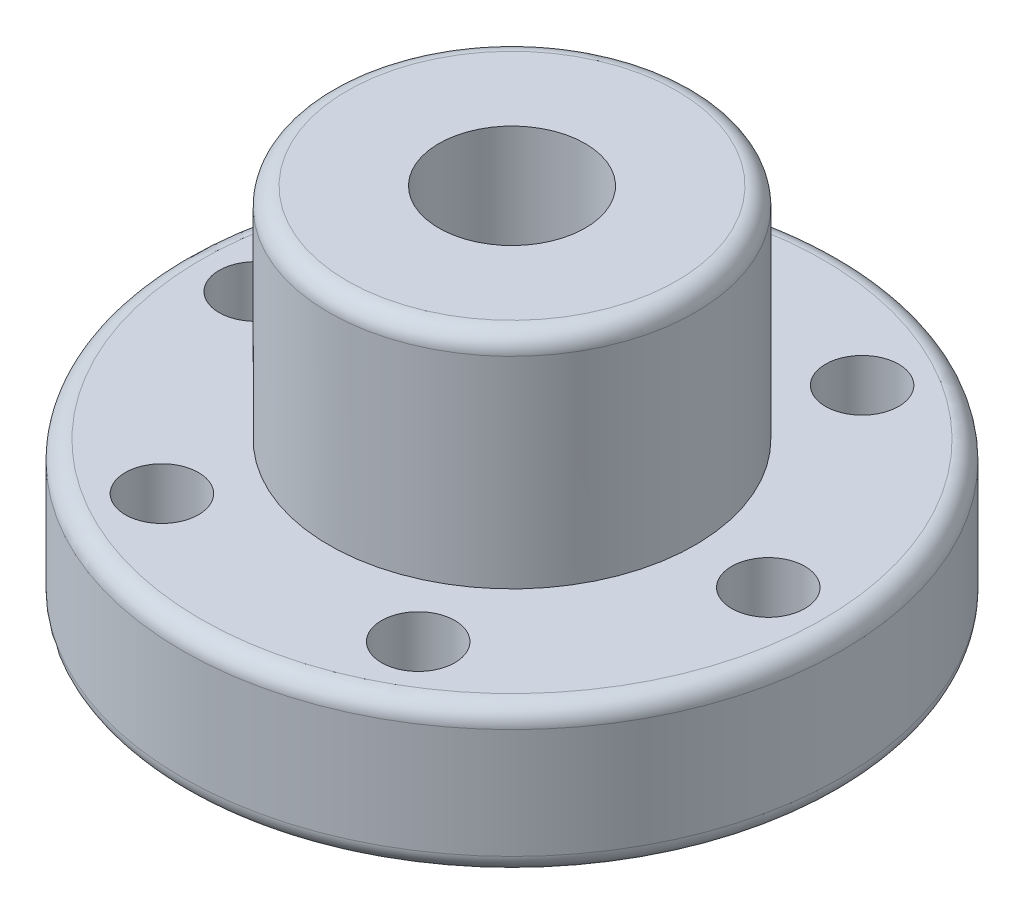
from build123d import *

# Parameters (mm, degrees)
FILLET1_R          = 1
SKETCH2_R          = 2
CUT_EXTRUDE1_DEPTH = 10


with BuildPart() as part:
    # Sketch1 → Revolve1 (revolve)
    with BuildSketch(Plane.XY, mode=Mode.PRIVATE) as revolve1_sk:
        Polygon((0, 0), (0, 20), (6, 20), (6, 8), (14, 8), (14, 0), align=None)
    revolve(revolve1_sk.sketch.rotate(Axis((-4, 0, 0), (0, 1, 0)), 90), axis=Axis((-4, 0, 0), (0, 1, 0)))

    # Fillet1
    fillet1_edges = [part.edges().sort_by_distance(p)[0] for p in [
        (-4, 0, 18),
        (-4, 8, 18),
        (-4, 20, 10),
    ]]
    fillet(fillet1_edges, radius=FILLET1_R)

    # Sketch2 → Cut-Extrude1 (cut)
    with BuildSketch(Plane(origin=(0, 0, 0), x_dir=(-1, 0, 0), z_dir=(0, -1, 0))):
        with Locations(Location((18, 0, 0), (0, 0, 90))):
            Circle(SKETCH2_R)
        with Locations(Location((11, -12.124355653, 0), (0, 0, 90))):
            Circle(SKETCH2_R)
        with Locations(Location((-3, -12.124355653, 0), (0, 0, 90))):
            Circle(SKETCH2_R)
        with Locations(Location((-10, 0, 0), (0, 0, 90))):
            Circle(SKETCH2_R)
        with Locations(Location((-3, 12.124355653, 0), (0, 0, 90))):
            Circle(SKETCH2_R)
        with Locations(Location((11, 12.124355653, 0), (0, 0, 90))):
            Circle(SKETCH2_R)
    extrude(amount=-CUT_EXTRUDE1_DEPTH, mode=Mode.SUBTRACT)


solid = part.part
